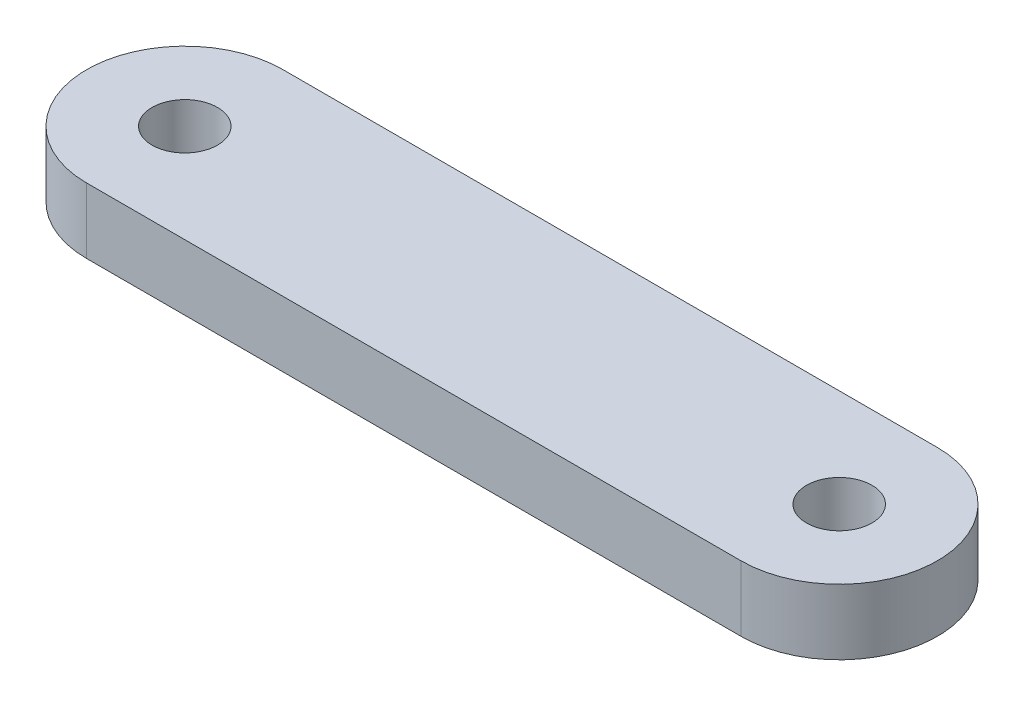
from build123d import *

# Parameters (mm, degrees)
RESSALTO_EXTRUS_O2_DEPTH = 10
ESBO_O4_R                = 5
CORTE_EXTRUS_O1_DEPTH    = 10


with BuildPart() as part:
    # Esboço3 → Ressalto-extrusão2 (new body)
    with BuildSketch(Plane(origin=(0, 0, 0), x_dir=(1, 0, 0), z_dir=(0, 1, 0))):
        with BuildLine():
            Line((-50, 15), (50, 15))
            ThreePointArc((50, 15), (65, 0), (50, -15))
            Line((50, -15), (-50, -15))
            ThreePointArc((-50, -15), (-65, 0), (-50, 15))
        make_face()
    extrude(amount=RESSALTO_EXTRUS_O2_DEPTH)

    # Esboço4 → Corte-extrusão1 (cut)
    with BuildSketch(Plane(origin=(0, 10, 0), x_dir=(1, 0, 0), z_dir=(0, 1, 0))):
        with Locations(Location((-50, 0, 0), (0, 0, 270))):
            Circle(ESBO_O4_R)
        with Locations(Location((50, 0, 0), (0, 0, 90))):
            Circle(ESBO_O4_R)
    extrude(amount=-CORTE_EXTRUS_O1_DEPTH, mode=Mode.SUBTRACT)


solid = part.part
